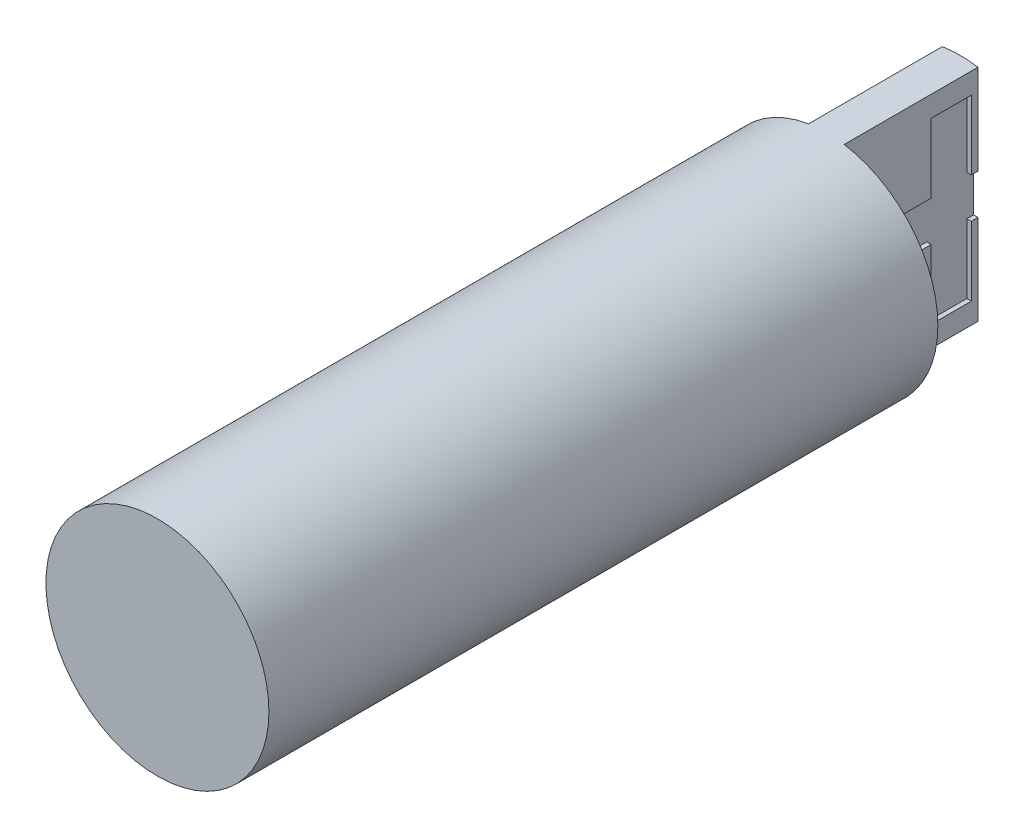
from build123d import *

# Parameters (mm, degrees)
ESQUISSE1_R             = 25
BOSS_EXTRU_1_DEPTH      = 150
BOSS_EXTRU_2_START      = 30
BOSS_EXTRU_2_DEPTH      = 30
ESQUISSE3_R             = 6
BOSS_EXTRU_3_DEPTH      = 9
BOSS_EXTRU_3_TAPER      = 1
ENL_V_MAT_EXTRU_1_DEPTH = 1


with BuildPart() as part:
    # Esquisse1 → Boss.-Extru.1 (new body)
    with BuildSketch(Plane.XY):
        Circle(ESQUISSE1_R)
    extrude(amount=BOSS_EXTRU_1_DEPTH)

    # Esquisse2 → Boss.-Extru.2 (add)
    with BuildSketch(Plane(origin=(0, 0, 0), x_dir=(-1, 0, 0), z_dir=(0, 0, -1)).offset(BOSS_EXTRU_2_START)):
        with BuildLine():
            Line((-4, -24.677925359), (-4, 24.677925359))
            ThreePointArc((-4, 24.677925359), (0, 25), (4, 24.677925359))
            Line((4, 24.677925359), (4, -24.677925359))
            ThreePointArc((4, -24.677925359), (0, -25), (-4, -24.677925359))
        make_face()
    extrude(amount=-BOSS_EXTRU_2_DEPTH)

    # Esquisse3 → Boss.-Extru.3 (add)
    with BuildSketch(Plane.ZY.offset(4)):
        with Locations((-24, 0)):
            Circle(ESQUISSE3_R)
    extrude(amount=BOSS_EXTRU_3_DEPTH, taper=BOSS_EXTRU_3_TAPER)

    # Esquisse4 → Enlèv. mat.-Extru.1 (cut)
    with BuildSketch(Plane(origin=(4, 0, 0), x_dir=(0, 0, -1), z_dir=(1, 0, 0))):
        Polygon((19.5, 4.5), (19.5, 20), (28.5, 20), (28.5, 4.5), (30, 4.5), (30, -4.5), (28.5, -4.5), (28.5, -20), (19.5, -20), (19.5, -4.5), (4, -4.5), (4, 4.5), align=None)
    extrude(amount=-ENL_V_MAT_EXTRU_1_DEPTH, mode=Mode.SUBTRACT)


solid = part.part
